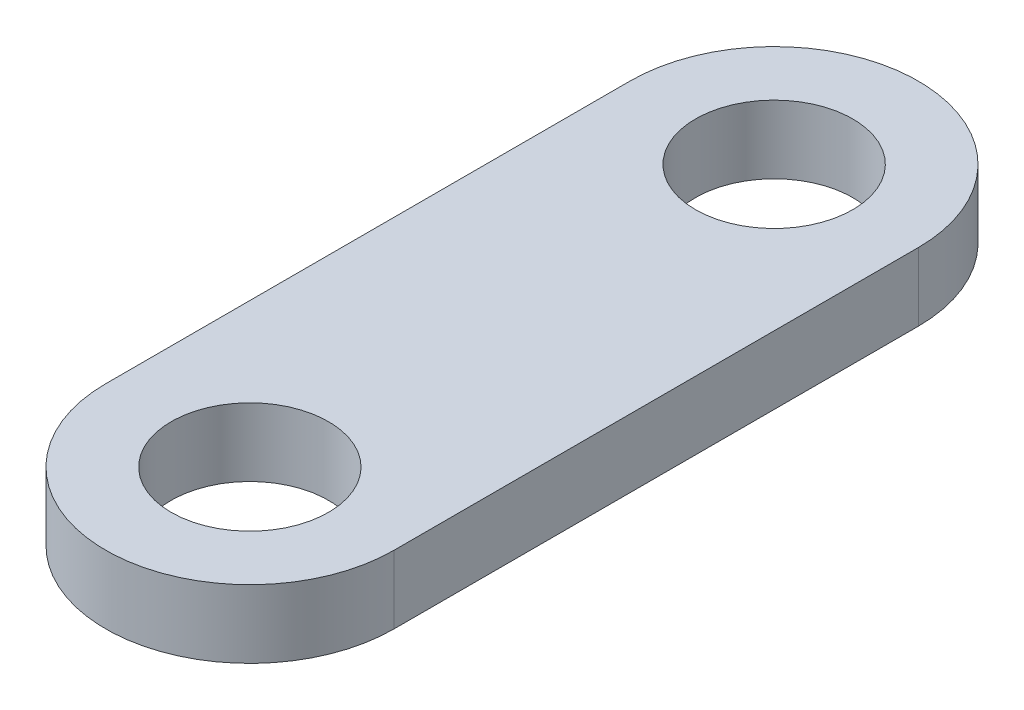
from build123d import *

# Parameters (mm, degrees)
SKETCH_1_R      = 3
EXTRUDE_1_DEPTH = 2.6


with BuildPart() as part:
    # 草图1 → 凸台-拉伸1 (new body)
    with BuildSketch(Plane(origin=(0, 0, 0), x_dir=(1, 0, 0), z_dir=(0, 1, 0))):
        with BuildLine():
            Line((-5.5, -10), (-5.5, 10))
            ThreePointArc((-5.5, 10), (0, 15.5), (5.5, 10))
            Line((5.5, 10), (5.5, -10))
            ThreePointArc((5.5, -10), (0, -15.5), (-5.5, -10))
        make_face()
        with Locations(Location((0, 10, 0), (0, 0, 270))):
            Circle(SKETCH_1_R, mode=Mode.SUBTRACT)
        with Locations(Location((0, -10, 0), (0, 0, 270))):
            Circle(SKETCH_1_R, mode=Mode.SUBTRACT)
    extrude(amount=EXTRUDE_1_DEPTH)


solid = part.part
